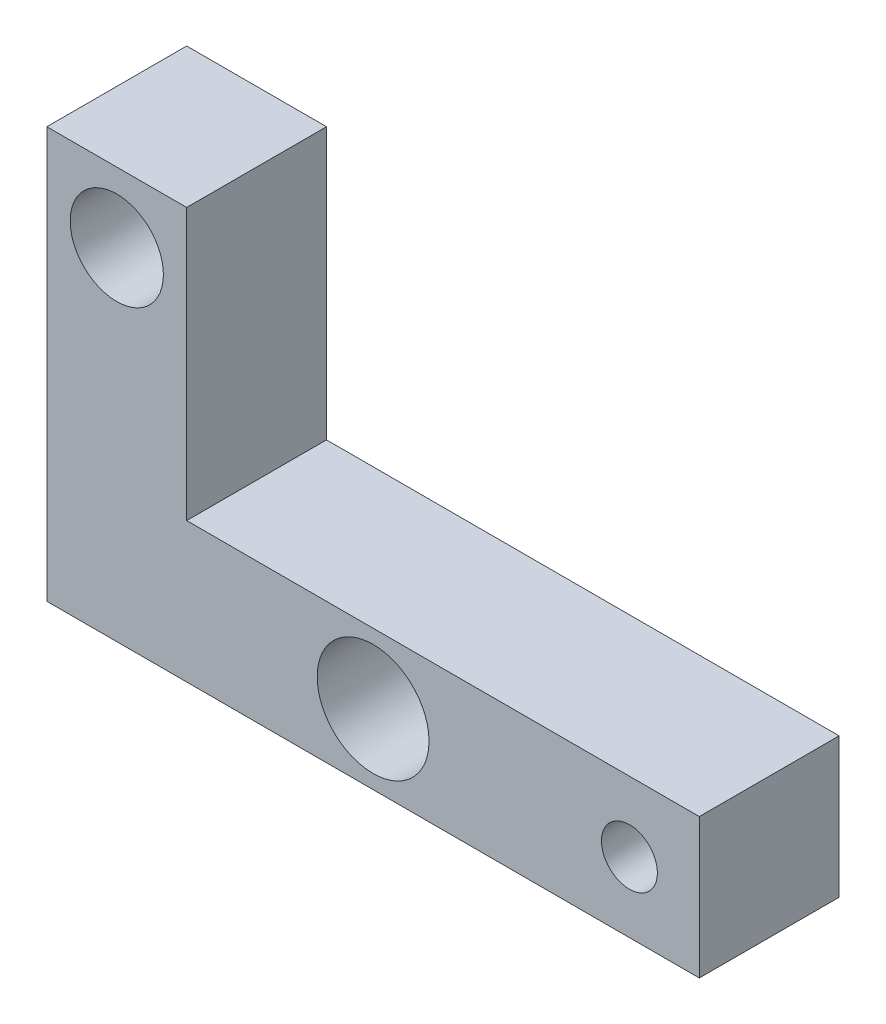
from build123d import *

# Parameters (mm, degrees)
SKETCH_1_R      = 5
SKETCH_1_R_2    = 3
SKETCH_1_R_3    = 6
EXTRUDE_1_DEPTH = 15


with BuildPart() as part:
    # 草圖1 → 填料-伸長1 (new body)
    with BuildSketch(Plane.XY):
        Polygon((0, 0), (0, 44.096222713), (15, 44.096222713), (15, 15), (70, 15), (70, 0), align=None)
        with Locations((7.5, 36.596222713)):
            Circle(SKETCH_1_R, mode=Mode.SUBTRACT)
        with Locations((62.5, 7.5)):
            Circle(SKETCH_1_R_2, mode=Mode.SUBTRACT)
        with Locations((35, 7.5)):
            Circle(SKETCH_1_R_3, mode=Mode.SUBTRACT)
    extrude(amount=EXTRUDE_1_DEPTH)


solid = part.part
